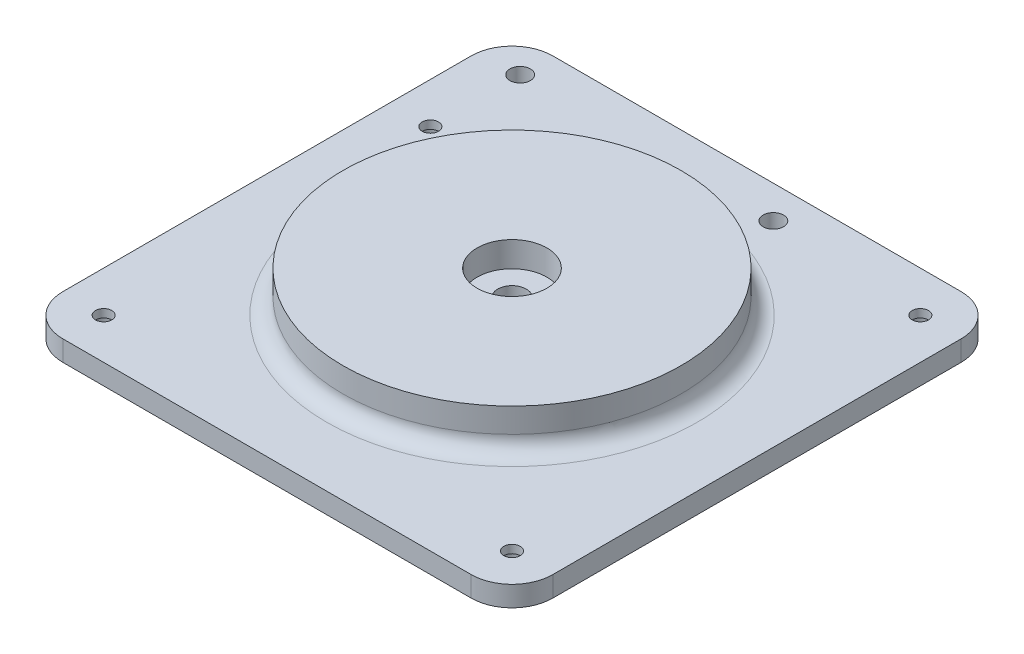
from build123d import *

# Parameters (mm, degrees)
CROQUIS1_R              = 41.4
SALIENTE_EXTRUIR1_DEPTH = 10
CROQUIS3_W              = 120
CROQUIS3_H              = 120
SALIENTE_EXTRUIR2_DEPTH = 5
CROQUIS2_R              = 3.5
CORTAR_EXTRUIR1_DEPTH   = 87.168439698
CROQUIS4_R              = 8.5
CORTAR_EXTRUIR2_DEPTH   = 6
CROQUIS5_W              = 42.3
CROQUIS5_H              = 42.3
SALIENTE_EXTRUIR3_DEPTH = 5
REDONDEO1_R             = 4
CORTAR_EXTRUIR3_REACH   = 134.292
CROQUIS8_R              = 2
CROQUIS8_R_2            = 11.5
CROQUIS9_R              = 3
CORTAR_EXTRUIR4_DEPTH   = 3
CORTAR_EXTRUIR5_REACH   = 98.188
CROQUIS10_R             = 2
CROQUIS11_W             = 17
CROQUIS11_H             = 42.3
SALIENTE_EXTRUIR4_DEPTH = 3
CROQUIS12_W             = 17
CROQUIS12_H             = 42.3
SALIENTE_EXTRUIR5_DEPTH = 3
CROQUIS15_W             = 17
CROQUIS15_H             = 3
SALIENTE_EXTRUIR6_DEPTH = 14
CROQUIS16_W             = 17
CROQUIS16_H             = 3
SALIENTE_EXTRUIR7_DEPTH = 15
CROQUIS13_R             = 2.5
CORTAR_EXTRUIR6_DEPTH   = 10
CROQUIS17_W             = 139.545471549
CROQUIS17_H             = 43.797559685
CORTAR_EXTRUIR7_DEPTH   = 120
REDONDEO2_R             = 10
REDONDEO3_R             = 10
REDONDEO4_R             = 10
REDONDEO5_R             = 10
CROQUIS18_R             = 8.55
CORTAR_EXTRUIR8_DEPTH   = 6.2


with BuildPart() as part:
    # Croquis1 → Saliente-Extruir1 (new body)
    with BuildSketch(Plane(origin=(0, 0, 0), x_dir=(1, 0, 0), z_dir=(0, 1, 0))):
        with Locations(Location((0, 0, 0), (0, 0, 270))):
            Circle(CROQUIS1_R)
    extrude(amount=SALIENTE_EXTRUIR1_DEPTH)

    # Croquis3 → Saliente-Extruir2 (add)
    with BuildSketch(Plane.XZ):
        Rectangle(CROQUIS3_W, CROQUIS3_H)
    extrude(amount=SALIENTE_EXTRUIR2_DEPTH)

    # Croquis2 → Cortar-Extruir1 (cut, through all)
    with BuildSketch(Plane(origin=(0, 10, 0), x_dir=(1, 0, 0), z_dir=(0, 1, 0))):
        with Locations(Location((0, 0, 0), (0, 0, 270))):
            Circle(CROQUIS2_R)
    extrude(amount=-CORTAR_EXTRUIR1_DEPTH, mode=Mode.SUBTRACT)

    # Croquis4 → Cortar-Extruir2 (cut)
    with BuildSketch(Plane.XZ.offset(5)):
        with Locations(Location((0, 0, 0), (0, 0, 270))):
            Circle(CROQUIS4_R)
    extrude(amount=-CORTAR_EXTRUIR2_DEPTH, mode=Mode.SUBTRACT)

    # Croquis5 → Saliente-Extruir3 (add)
    with BuildSketch(Plane.XY.offset(-43)):
        with Locations((-19.5, -26.15)):
            Rectangle(CROQUIS5_W, CROQUIS5_H)
    extrude(amount=-SALIENTE_EXTRUIR3_DEPTH)

    # Redondeo1
    redondeo1_edges = [part.edges().sort_by_distance(p)[0] for p in [
        (0, 0, -41.4),
    ]]
    fillet(redondeo1_edges, radius=REDONDEO1_R)

    # Croquis8 → Cortar-Extruir3 (cut, up to next)
    with BuildSketch(Plane(origin=(0, 0, -48), x_dir=(-1, 0, 0), z_dir=(0, 0, -1)), mode=Mode.PRIVATE) as cortar_extruir3_sk1:
        with Locations((4, -10.65)):
            Circle(CROQUIS8_R)
    cortar_extruir3_tool1 = extrude(cortar_extruir3_sk1.sketch, amount=-CORTAR_EXTRUIR3_REACH, mode=Mode.PRIVATE) & part.part
    # Croquis8 → Cortar-Extruir3 (cut, up to next)
    with BuildSketch(Plane(origin=(0, 0, -48), x_dir=(-1, 0, 0), z_dir=(0, 0, -1)), mode=Mode.PRIVATE) as cortar_extruir3_sk2:
        with Locations((35, -10.65)):
            Circle(CROQUIS8_R)
    cortar_extruir3_tool2 = extrude(cortar_extruir3_sk2.sketch, amount=-CORTAR_EXTRUIR3_REACH, mode=Mode.PRIVATE) & part.part
    # Croquis8 → Cortar-Extruir3 (cut, up to next)
    with BuildSketch(Plane(origin=(0, 0, -48), x_dir=(-1, 0, 0), z_dir=(0, 0, -1)), mode=Mode.PRIVATE) as cortar_extruir3_sk3:
        with Locations((35, -41.65)):
            Circle(CROQUIS8_R)
    cortar_extruir3_tool3 = extrude(cortar_extruir3_sk3.sketch, amount=-CORTAR_EXTRUIR3_REACH, mode=Mode.PRIVATE) & part.part
    # Croquis8 → Cortar-Extruir3 (cut, up to next)
    with BuildSketch(Plane(origin=(0, 0, -48), x_dir=(-1, 0, 0), z_dir=(0, 0, -1)), mode=Mode.PRIVATE) as cortar_extruir3_sk4:
        with Locations((4, -41.65)):
            Circle(CROQUIS8_R)
    cortar_extruir3_tool4 = extrude(cortar_extruir3_sk4.sketch, amount=-CORTAR_EXTRUIR3_REACH, mode=Mode.PRIVATE) & part.part
    # Croquis8 → Cortar-Extruir3 (cut, up to next)
    with BuildSketch(Plane(origin=(0, 0, -48), x_dir=(-1, 0, 0), z_dir=(0, 0, -1)), mode=Mode.PRIVATE) as cortar_extruir3_sk5:
        with Locations((19.5, -26.15)):
            Circle(CROQUIS8_R_2)
    cortar_extruir3_tool5 = extrude(cortar_extruir3_sk5.sketch, amount=-CORTAR_EXTRUIR3_REACH, mode=Mode.PRIVATE) & part.part
    add(cortar_extruir3_tool1.solids().sort_by_distance((-4, -10.65, -48))[0], mode=Mode.SUBTRACT)
    add(cortar_extruir3_tool2.solids().sort_by_distance((-35, -10.65, -48))[0], mode=Mode.SUBTRACT)
    add(cortar_extruir3_tool3.solids().sort_by_distance((-35, -41.65, -48))[0], mode=Mode.SUBTRACT)
    add(cortar_extruir3_tool4.solids().sort_by_distance((-4, -41.65, -48))[0], mode=Mode.SUBTRACT)
    add(cortar_extruir3_tool5.solids().sort_by_distance((-19.5, -26.15, -48))[0], mode=Mode.SUBTRACT)

    # Croquis9 → Cortar-Extruir4 (cut)
    with BuildSketch(Plane.XZ.offset(5)):
        with Locations(Location((-50, 50, 0), (0, 0, 270))):
            Circle(CROQUIS9_R)
        with Locations(Location((50, 50, 0), (0, 0, 270))):
            Circle(CROQUIS9_R)
        with Locations(Location((50, -50, 0), (0, 0, 270))):
            Circle(CROQUIS9_R)
        with Locations(Location((-50, -30, 0), (0, 0, 270))):
            Circle(CROQUIS9_R)
    extrude(amount=-CORTAR_EXTRUIR4_DEPTH, mode=Mode.SUBTRACT)

    # Croquis10 → Cortar-Extruir5 (cut, up to next)
    with BuildSketch(Plane.XZ.offset(2), mode=Mode.PRIVATE) as cortar_extruir5_sk1:
        with Locations(Location((-50, 50, 0), (0, 0, 270))):
            Circle(CROQUIS10_R)
    cortar_extruir5_tool1 = extrude(cortar_extruir5_sk1.sketch, amount=-CORTAR_EXTRUIR5_REACH, mode=Mode.PRIVATE) & part.part
    # Croquis10 → Cortar-Extruir5 (cut, up to next)
    with BuildSketch(Plane.XZ.offset(2), mode=Mode.PRIVATE) as cortar_extruir5_sk2:
        with Locations(Location((50, 50, 0), (0, 0, 270))):
            Circle(CROQUIS10_R)
    cortar_extruir5_tool2 = extrude(cortar_extruir5_sk2.sketch, amount=-CORTAR_EXTRUIR5_REACH, mode=Mode.PRIVATE) & part.part
    # Croquis10 → Cortar-Extruir5 (cut, up to next)
    with BuildSketch(Plane.XZ.offset(2), mode=Mode.PRIVATE) as cortar_extruir5_sk3:
        with Locations(Location((50, -50, 0), (0, 0, 270))):
            Circle(CROQUIS10_R)
    cortar_extruir5_tool3 = extrude(cortar_extruir5_sk3.sketch, amount=-CORTAR_EXTRUIR5_REACH, mode=Mode.PRIVATE) & part.part
    # Croquis10 → Cortar-Extruir5 (cut, up to next)
    with BuildSketch(Plane.XZ.offset(2), mode=Mode.PRIVATE) as cortar_extruir5_sk4:
        with Locations(Location((-50, -30, 0), (0, 0, 270))):
            Circle(CROQUIS10_R)
    cortar_extruir5_tool4 = extrude(cortar_extruir5_sk4.sketch, amount=-CORTAR_EXTRUIR5_REACH, mode=Mode.PRIVATE) & part.part
    add(cortar_extruir5_tool1.solids().sort_by_distance((-50, -2, 50))[0], mode=Mode.SUBTRACT)
    add(cortar_extruir5_tool2.solids().sort_by_distance((50, -2, 50))[0], mode=Mode.SUBTRACT)
    add(cortar_extruir5_tool3.solids().sort_by_distance((50, -2, -50))[0], mode=Mode.SUBTRACT)
    add(cortar_extruir5_tool4.solids().sort_by_distance((-50, -2, -30))[0], mode=Mode.SUBTRACT)

    # Croquis11 → Saliente-Extruir4 (add)
    with BuildSketch(Plane(origin=(1.65, 0, 0), x_dir=(0, 0, -1), z_dir=(1, 0, 0))):
        with Locations((51.5, -26.15)):
            Rectangle(CROQUIS11_W, CROQUIS11_H)
    extrude(amount=SALIENTE_EXTRUIR4_DEPTH)

    # Croquis12 → Saliente-Extruir5 (add)
    with BuildSketch(Plane.ZY.offset(40.65)):
        with Locations((-51.5, -26.15)):
            Rectangle(CROQUIS12_W, CROQUIS12_H)
    extrude(amount=SALIENTE_EXTRUIR5_DEPTH)

    # Croquis15 → Saliente-Extruir6 (add)
    with BuildSketch(Plane.ZY.offset(43.65)):
        with Locations((-51.5, -6.5)):
            Rectangle(CROQUIS15_W, CROQUIS15_H)
    extrude(amount=SALIENTE_EXTRUIR6_DEPTH)

    # Croquis16 → Saliente-Extruir7 (add)
    with BuildSketch(Plane(origin=(4.65, 0, 0), x_dir=(0, 0, -1), z_dir=(1, 0, 0))):
        with Locations((51.5, -6.5)):
            Rectangle(CROQUIS16_W, CROQUIS16_H)
    extrude(amount=SALIENTE_EXTRUIR7_DEPTH)

    # Croquis13 → Cortar-Extruir6 (cut)
    with BuildSketch(Plane(origin=(0, 0, 0), x_dir=(1, 0, 0), z_dir=(0, 1, 0))):
        with Locations(Location((-50, 52, 0), (0, 0, 270))):
            Circle(CROQUIS13_R)
        with Locations(Location((12, 52, 0), (0, 0, 270))):
            Circle(CROQUIS13_R)
    extrude(amount=-CORTAR_EXTRUIR6_DEPTH, mode=Mode.SUBTRACT)

    # Croquis17 → Cortar-Extruir7 (cut)
    with BuildSketch(Plane(origin=(0, 0, -60), x_dir=(-1, 0, 0), z_dir=(0, 0, -1))):
        with Locations((9.772735774, -26.898779843)):
            Rectangle(CROQUIS17_W, CROQUIS17_H)
    extrude(amount=-CORTAR_EXTRUIR7_DEPTH, mode=Mode.SUBTRACT)

    # Redondeo2
    redondeo2_edges = [part.edges().sort_by_distance(p)[0] for p in [
        (60, -2.5, -60),
    ]]
    fillet(redondeo2_edges, radius=REDONDEO2_R)

    # Redondeo3
    redondeo3_edges = [part.edges().sort_by_distance(p)[0] for p in [
        (-60, -2.5, -60),
    ]]
    fillet(redondeo3_edges, radius=REDONDEO3_R)

    # Redondeo4
    redondeo4_edges = [part.edges().sort_by_distance(p)[0] for p in [
        (-60, -2.5, 60),
    ]]
    fillet(redondeo4_edges, radius=REDONDEO4_R)

    # Redondeo5
    redondeo5_edges = [part.edges().sort_by_distance(p)[0] for p in [
        (60, -2.5, 60),
    ]]
    fillet(redondeo5_edges, radius=REDONDEO5_R)

    # Croquis18 → Cortar-Extruir8 (cut)
    with BuildSketch(Plane(origin=(0, 10, 0), x_dir=(1, 0, 0), z_dir=(0, 1, 0))):
        with Locations(Location((0, 0, 0), (0, 0, 270))):
            Circle(CROQUIS18_R)
    extrude(amount=-CORTAR_EXTRUIR8_DEPTH, mode=Mode.SUBTRACT)


solid = part.part
